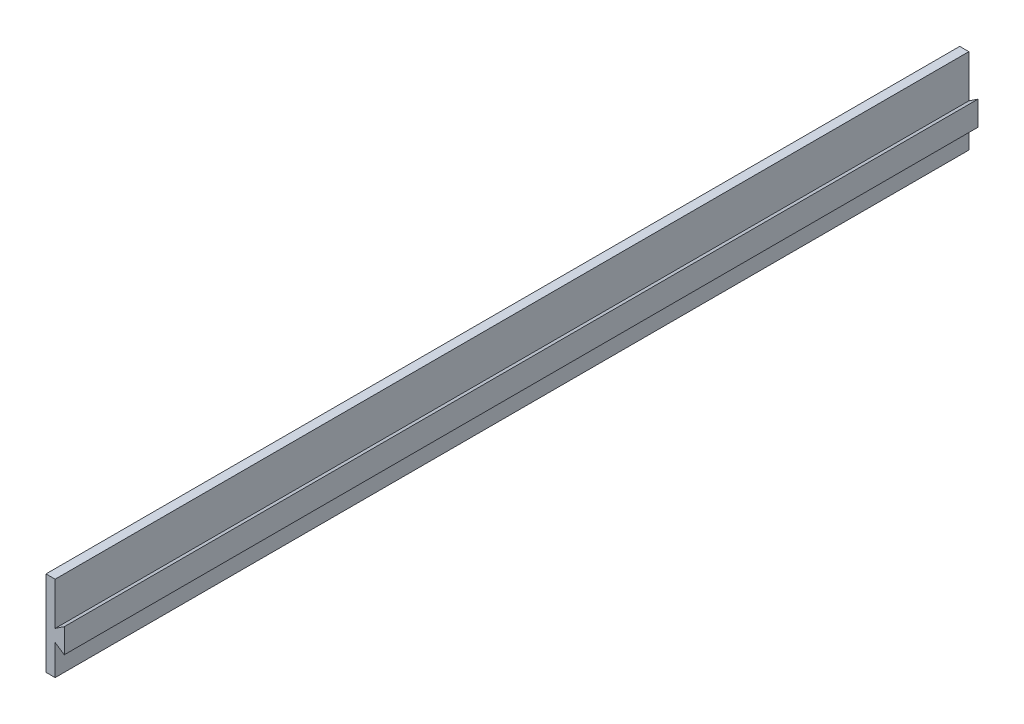
from build123d import *

# Parameters (mm, degrees)
BOSS_EXTRUDE1_DEPTH = 1500
SKETCH3_R           = 4
BOSS_EXTRUDE2_DEPTH = 20


with BuildPart() as part:
    # Sketch2 → Boss-Extrude1 (new body)
    with BuildSketch(Plane.XY):
        Polygon((0, -70), (0, -20), (15, -30), (15, 10), (0, 0), (0, 70), (-15, 70), (-15, -70), align=None)
    extrude(amount=BOSS_EXTRUDE1_DEPTH)

    # Sketch3 → Boss-Extrude2 (add)
    with BuildSketch(Plane.ZY.offset(15)):
        with Locations(Location((750, -60, 0), (0, 0, 90))):
            Circle(SKETCH3_R)
    extrude(amount=BOSS_EXTRUDE2_DEPTH)


solid = part.part
